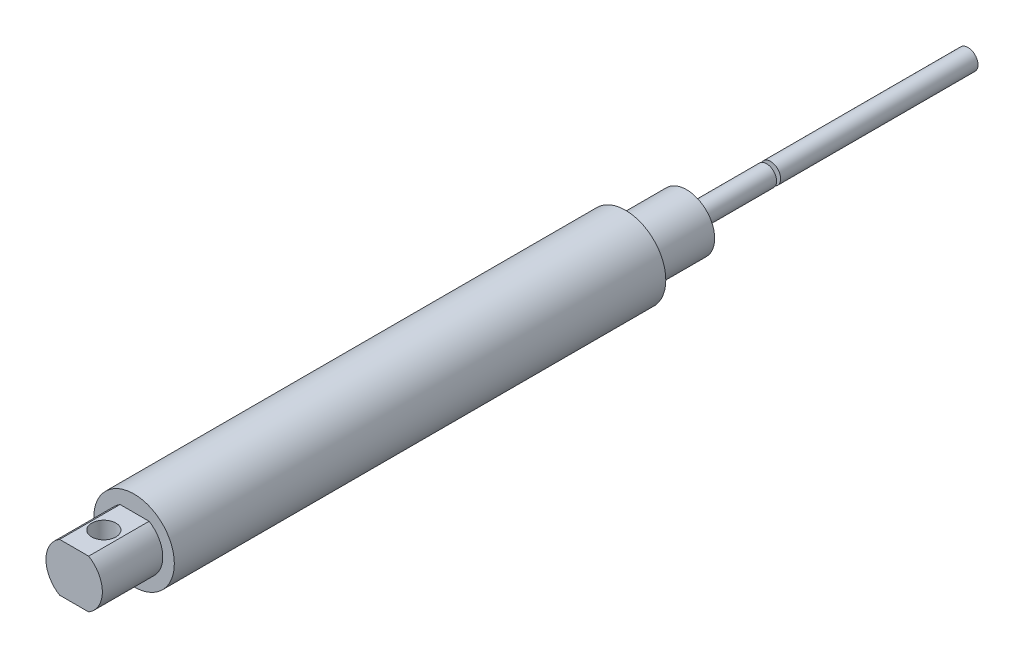
from build123d import *

# Parameters (mm, degrees)
SKETCH_1_R          = 10
EXTRUDE_1_DEPTH     = 152
CUT_EXTRUDE_START   = -15
SKETCH_2_R          = 10
SKETCH_2_R_2        = 7
CUT_EXTRUDE_1_DEPTH = 15
CUT_EXTRUDE_START_2 = -152
SKETCH_2_3_R        = 10
SKETCH_2_3_R_2      = 7
CUT_EXTRUDE_2_DEPTH = 15
SKETCH_3_R          = 3
CUT_EXTRUDE_3_DEPTH = 154.166575988
SKETCH_4_R          = 2.5
EXTRUDE_2_DEPTH     = 20
EXTRUDE_START       = 21
SKETCH_4_2_R        = 2.5
EXTRUDE_3_DEPTH     = 49


with BuildPart() as part:
    # 草图1 → 凸台-拉伸1 (new body)
    with BuildSketch(Plane.XY):
        Circle(SKETCH_1_R)
    extrude(amount=EXTRUDE_1_DEPTH)

    # 草图2 → 切除-拉伸1 (cut)
    # profile 1 of 3: a face of its own
    with BuildSketch(Plane.XY.offset(152).offset(CUT_EXTRUDE_START)):
        Circle(SKETCH_2_R)
        with Locations((0.131100685, 0)):
            Circle(SKETCH_2_R_2, mode=Mode.SUBTRACT)
    # profile 2 of 3: a face of its own
    with BuildSketch(Plane.XY.offset(152).offset(CUT_EXTRUDE_START)):
        with BuildLine():
            Line((3.73665196, -6), (-3.47445059, -6))
            ThreePointArc((-3.47445059, -6), (0.131100685, -7), (3.73665196, -6))
        make_face()
    # profile 3 of 3: a face of its own
    with BuildSketch(Plane.XY.offset(152).offset(CUT_EXTRUDE_START)):
        with BuildLine():
            ThreePointArc((3.73665196, 6), (0.131100685, 7), (-3.47445059, 6))
            Line((-3.47445059, 6), (3.73665196, 6))
        make_face()
    extrude(amount=CUT_EXTRUDE_1_DEPTH, mode=Mode.SUBTRACT)

    # 草图2<3> → 切除-拉伸2 (cut)
    with BuildSketch(Plane.XY.offset(152).offset(CUT_EXTRUDE_START_2)):
        Circle(SKETCH_2_3_R)
        with Locations((0.131100685, 0)):
            Circle(SKETCH_2_3_R_2, mode=Mode.SUBTRACT)
    extrude(amount=CUT_EXTRUDE_2_DEPTH, mode=Mode.SUBTRACT)

    # 草图3 → 切除-拉伸3 (cut, through all)
    with BuildSketch(Plane(origin=(0, 6, 0), x_dir=(1, 0, 0), z_dir=(0, 1, 0))):
        with Locations(Location((0, -144.5, 0), (0, 0, 270))):
            Circle(SKETCH_3_R)
    extrude(amount=-CUT_EXTRUDE_3_DEPTH, mode=Mode.SUBTRACT)

    # 草图4 → 凸台-拉伸2 (add)
    with BuildSketch(Plane(origin=(0, 0, 0), x_dir=(-1, 0, 0), z_dir=(0, 0, -1))):
        Circle(SKETCH_4_R)
    extrude(amount=EXTRUDE_2_DEPTH)


with BuildPart() as body_2:
    # 草图4<2> → 凸台-拉伸3 (new body)
    with BuildSketch(Plane(origin=(0, 0, 0), x_dir=(-1, 0, 0), z_dir=(0, 0, -1)).offset(EXTRUDE_START)):
        Circle(SKETCH_4_2_R)
    extrude(amount=EXTRUDE_3_DEPTH)


solid = Compound([part.part, body_2.part])
